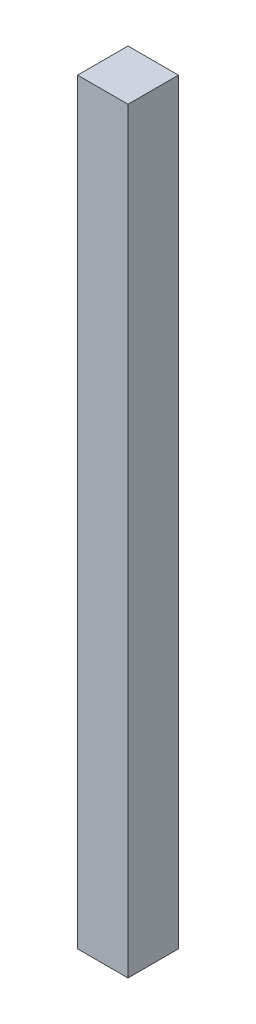
from build123d import *

# Parameters (mm, degrees)
SKETCH1_W           = 20
SKETCH1_H           = 20
BOSS_EXTRUDE1_DEPTH = 300


with BuildPart() as part:
    # Sketch1 → Boss-Extrude1 (new body)
    with BuildSketch(Plane(origin=(0, 0, 0), x_dir=(1, 0, 0), z_dir=(0, 1, 0))):
        Rectangle(SKETCH1_W, SKETCH1_H)
    extrude(amount=BOSS_EXTRUDE1_DEPTH)


solid = part.part
